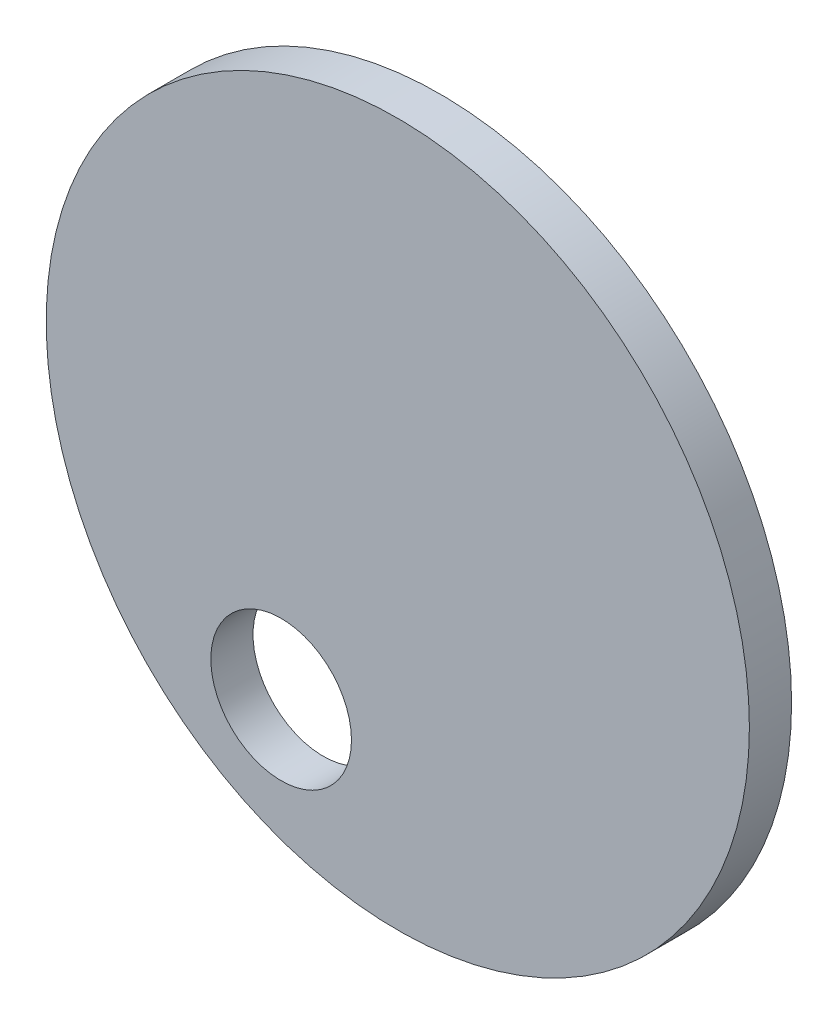
from build123d import *

# Parameters (mm, degrees)
ESQUISSE1_R             = 25
BOSS_EXTRU_1_DEPTH      = 3
ESQUISSE3_R             = 6
BOSS_EXTRU_3_DEPTH      = 9
ESQUISSE4_R             = 5
ENL_V_MAT_EXTRU_2_DEPTH = 5


with BuildPart() as part:
    # Esquisse1 → Boss.-Extru.1 (new body)
    with BuildSketch(Plane.XY):
        Circle(ESQUISSE1_R)
    extrude(amount=BOSS_EXTRU_1_DEPTH)

    # Esquisse3 → Boss.-Extru.3 (add)
    with BuildSketch(Plane(origin=(0, 0, 0), x_dir=(-1, 0, 0), z_dir=(0, 0, -1))):
        Circle(ESQUISSE3_R)
        with BuildLine():
            Line((-1.397318861, 1.5), (1.397318861, 1.5))
            ThreePointArc((1.397318861, 1.5), (0, -2.05), (-1.397318861, 1.5))
        make_face(mode=Mode.SUBTRACT)
    extrude(amount=BOSS_EXTRU_3_DEPTH)

    # Esquisse4 → Enlèv. mat.-Extru.2 (cut)
    with BuildSketch(Plane.XY.offset(3)):
        with Locations((-8.295445994, -14.94087289)):
            Circle(ESQUISSE4_R)
    extrude(amount=-ENL_V_MAT_EXTRU_2_DEPTH, mode=Mode.SUBTRACT)


solid = part.part
